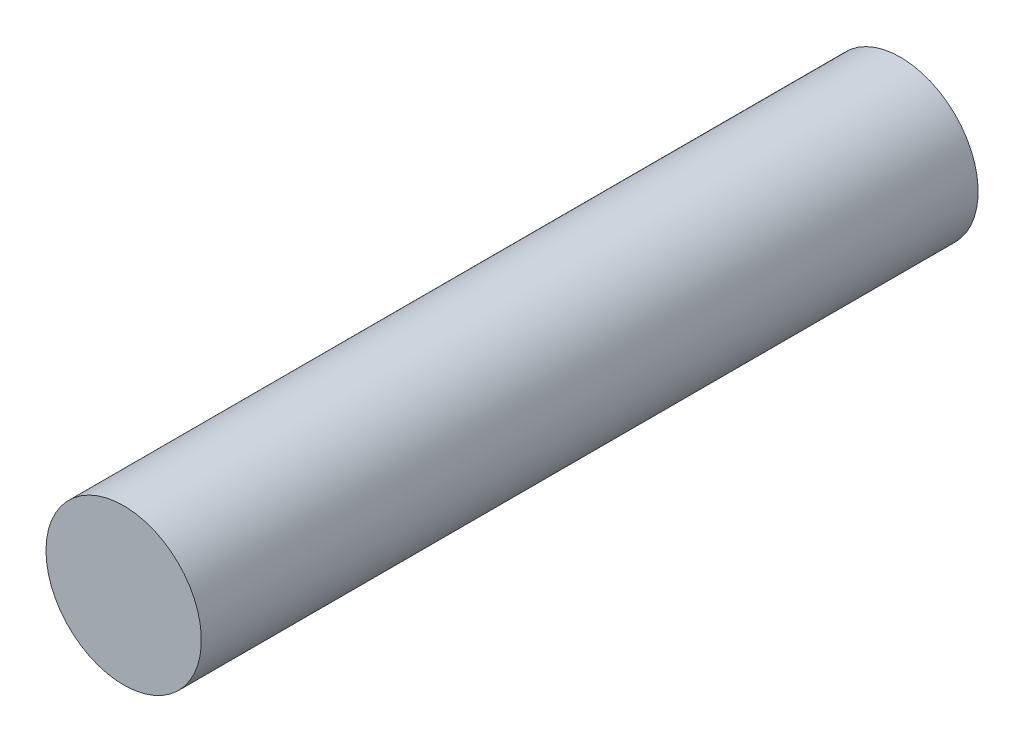
from build123d import *

# Parameters (mm, degrees)
SKETCH1_R           = 7.9375
BOSS_EXTRUDE1_DEPTH = 79.375


with BuildPart() as part:
    # Sketch1 → Boss-Extrude1 (new body)
    with BuildSketch(Plane.XY):
        with Locations(Location((0, 0, 0), (0, 0, 180))):
            Circle(SKETCH1_R)
    extrude(amount=BOSS_EXTRUDE1_DEPTH)


solid = part.part
